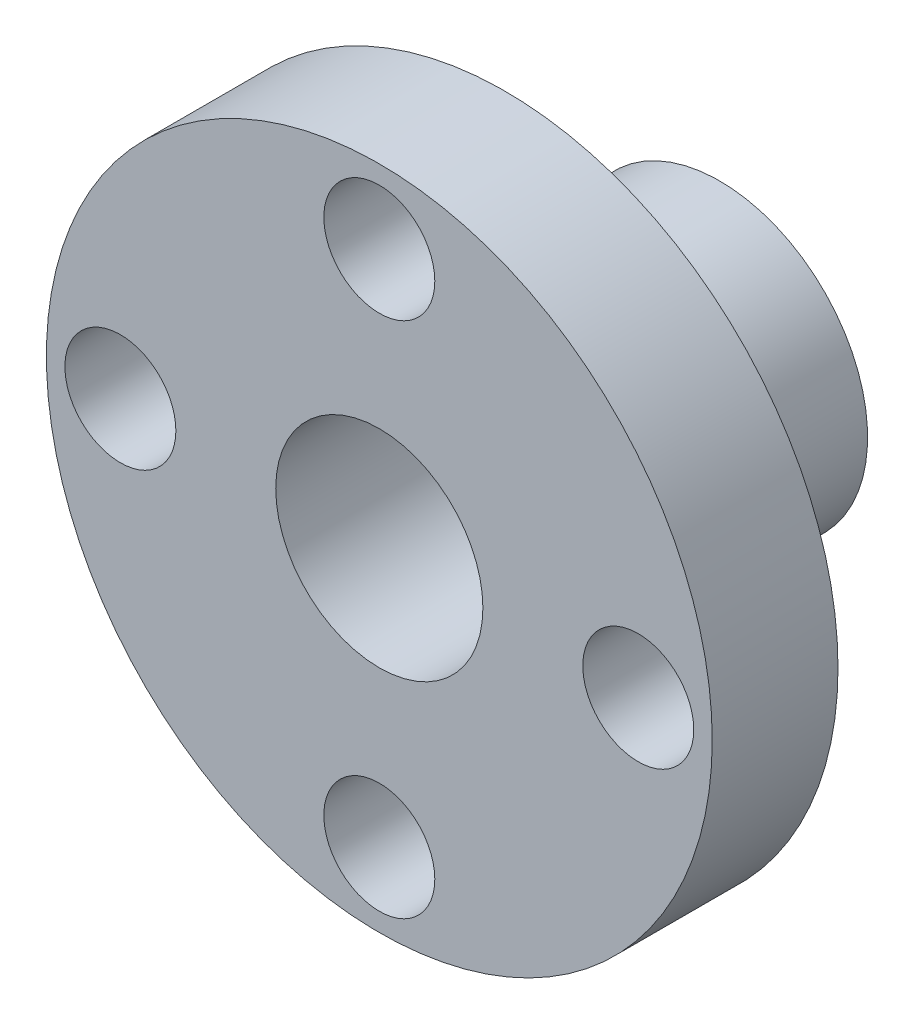
from build123d import *

# Parameters (mm, degrees)
SKETCH2_R                = 225
SKETCH2_R_2              = 100
BOSS_EXTRUDE1_DEPTH      = 85
BOSS_EXTRUDE2_DEPTH      = 145
BOSS_EXTRUDE2_DEPTH_BACK = 85
SKETCH3_R                = 100
SKETCH4_R                = 70
CUT_EXTRUDE1_DEPTH       = 315
SKETCH5_R                = 37.5
CUT_EXTRUDE2_DEPTH       = 85


with BuildPart() as part:
    # Sketch2 → Boss-Extrude1 (new body)
    with BuildSketch(Plane.XY):
        Circle(SKETCH2_R)
        Circle(SKETCH2_R_2, mode=Mode.SUBTRACT)
    extrude(amount=BOSS_EXTRUDE1_DEPTH)

    # Sketch3 → Boss-Extrude2 (add, two sides: drawn at the far end of the back side and taken through both)
    with BuildSketch(Plane(origin=(0, 0, 0), x_dir=(-1, 0, 0), z_dir=(0, 0, -1)).offset(-BOSS_EXTRUDE2_DEPTH_BACK)):
        Circle(SKETCH3_R)
    extrude(amount=BOSS_EXTRUDE2_DEPTH + BOSS_EXTRUDE2_DEPTH_BACK)

    # Sketch4 → Cut-Extrude1 (cut)
    with BuildSketch(Plane(origin=(0, 0, -145), x_dir=(-1, 0, 0), z_dir=(0, 0, -1))):
        Circle(SKETCH4_R)
    extrude(amount=-CUT_EXTRUDE1_DEPTH, mode=Mode.SUBTRACT)

    # Sketch5 → Cut-Extrude2 (cut)
    with BuildSketch(Plane.XY.offset(85)):
        with Locations((175, 0)):
            Circle(SKETCH5_R)
        with Locations((0, 175)):
            Circle(SKETCH5_R)
        with Locations((-175, 0)):
            Circle(SKETCH5_R)
        with Locations((0, -175)):
            Circle(SKETCH5_R)
    extrude(amount=-CUT_EXTRUDE2_DEPTH, mode=Mode.SUBTRACT)


solid = part.part
